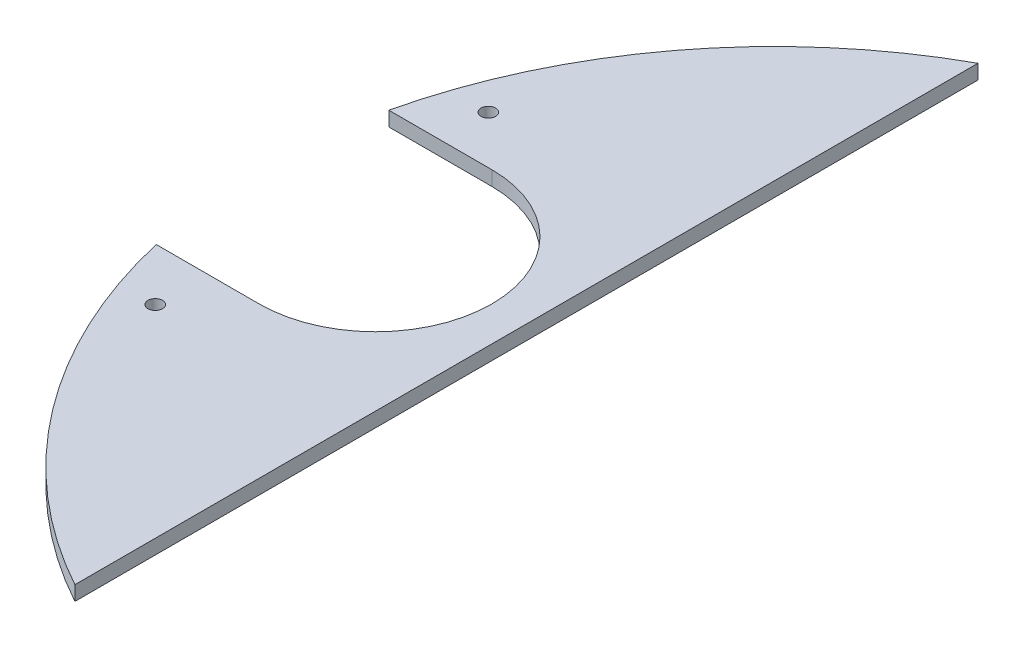
from build123d import *

# Parameters (mm, degrees)
BOSS_EXTRUDE1_DEPTH = 3.175
SKETCH2_R           = 1.5875
SKETCH2_W           = 80.264
SKETCH2_H           = 12.954
CUT_EXTRUDE1_DEPTH  = 223.985606318
SKETCH7_R           = 1.5875
SKETCH7_W           = 46.99
SKETCH7_H           = 138.43
CUT_EXTRUDE4_DEPTH  = 223.985606318
CUT_EXTRUDE5_DEPTH  = 223.985606318
SKETCH9_W           = 300.072277348
SKETCH9_H           = 334.026066528
CUT_EXTRUDE6_DEPTH  = 221.482742149
SKETCH10_R          = 1.5875
CUT_EXTRUDE7_DEPTH  = 214.733203623


with BuildPart() as part:
    # Sketch1 → Boss-Extrude1 (new body)
    with BuildSketch(Plane(origin=(0, 0, 0), x_dir=(1, 0, 0), z_dir=(0, 1, 0))):
        with BuildLine():
            Line((-80, 112.5), (100, 112.5))
            Line((100, 112.5), (100, -112.5))
            Line((100, -112.5), (-80, -112.5))
            ThreePointArc((-80, -112.5), (-192.5, 0), (-80, 112.5))
        make_face()
    extrude(amount=-BOSS_EXTRUDE1_DEPTH)

    # Sketch2 → Cut-Extrude1 (cut, through all)
    with BuildSketch(Plane(origin=(0, 0, 0), x_dir=(1, 0, 0), z_dir=(0, 1, 0))):
        with Locations(Location((36.144045702, -74.2188, 0), (0, 0, 270))):
            Circle(SKETCH2_R)
        with Locations(Location((36.144045702, -67.8688, 0), (0, 0, 270))):
            Circle(SKETCH2_R)
        with Locations(Location((36.144045702, -61.5188, 0), (0, 0, 270))):
            Circle(SKETCH2_R)
        with Locations(Location((36.144045702, -55.1688, 0), (0, 0, 270))):
            Circle(SKETCH2_R)
        with Locations(Location((36.144045702, -48.8188, 0), (0, 0, 270))):
            Circle(SKETCH2_R)
        with Locations(Location((36.144045702, -42.4688, 0), (0, 0, 270))):
            Circle(SKETCH2_R)
        with Locations(Location((36.144045702, -36.1188, 0), (0, 0, 270))):
            Circle(SKETCH2_R)
        with Locations(Location((67.894045702, -74.2188, 0), (0, 0, 270))):
            Circle(SKETCH2_R)
        with Locations(Location((67.894045702, -67.8688, 0), (0, 0, 270))):
            Circle(SKETCH2_R)
        with Locations(Location((67.894045702, -61.5188, 0), (0, 0, 270))):
            Circle(SKETCH2_R)
        with Locations(Location((67.894045702, -55.1688, 0), (0, 0, 270))):
            Circle(SKETCH2_R)
        with Locations(Location((67.894045702, -48.8188, 0), (0, 0, 270))):
            Circle(SKETCH2_R)
        with Locations(Location((67.894045702, -42.4688, 0), (0, 0, 270))):
            Circle(SKETCH2_R)
        with Locations(Location((67.894045702, -36.1188, 0), (0, 0, 270))):
            Circle(SKETCH2_R)
        with Locations(Location((36.144045702, 74.2188, 0), (0, 0, 270))):
            Circle(SKETCH2_R)
        with Locations(Location((36.144045702, 67.8688, 0), (0, 0, 270))):
            Circle(SKETCH2_R)
        with Locations(Location((36.144045702, 61.5188, 0), (0, 0, 270))):
            Circle(SKETCH2_R)
        with Locations(Location((36.144045702, 55.1688, 0), (0, 0, 270))):
            Circle(SKETCH2_R)
        with Locations(Location((36.144045702, 48.8188, 0), (0, 0, 270))):
            Circle(SKETCH2_R)
        with Locations(Location((36.144045702, 42.4688, 0), (0, 0, 270))):
            Circle(SKETCH2_R)
        with Locations(Location((36.144045702, 36.1188, 0), (0, 0, 270))):
            Circle(SKETCH2_R)
        with Locations(Location((67.894045702, 74.2188, 0), (0, 0, 270))):
            Circle(SKETCH2_R)
        with Locations(Location((67.894045702, 67.8688, 0), (0, 0, 270))):
            Circle(SKETCH2_R)
        with Locations(Location((67.894045702, 61.5188, 0), (0, 0, 270))):
            Circle(SKETCH2_R)
        with Locations(Location((67.894045702, 55.1688, 0), (0, 0, 270))):
            Circle(SKETCH2_R)
        with Locations(Location((67.894045702, 48.8188, 0), (0, 0, 270))):
            Circle(SKETCH2_R)
        with Locations(Location((67.894045702, 42.4688, 0), (0, 0, 270))):
            Circle(SKETCH2_R)
        with Locations(Location((67.894045702, 36.1188, 0), (0, 0, 270))):
            Circle(SKETCH2_R)
        with Locations((52.019045702, -96.4438)):
            Rectangle(SKETCH2_W, SKETCH2_H)
        with Locations((52.019045702, 96.4438)):
            Rectangle(SKETCH2_W, SKETCH2_H)
    extrude(amount=-CUT_EXTRUDE1_DEPTH, mode=Mode.SUBTRACT)

    # Sketch7 → Cut-Extrude4 (cut, through all)
    with BuildSketch(Plane(origin=(0, 0, 0), x_dir=(1, 0, 0), z_dir=(0, 1, 0))):
        with Locations(Location((-50.166143469, 0, 0), (0, 0, 270))):
            Circle(SKETCH7_R)
        with Locations(Location((25.582761582, 0, 0), (0, 0, 270))):
            Circle(SKETCH7_R)
        with Locations(Location((87.462148806, 0, 0), (0, 0, 270))):
            Circle(SKETCH7_R)
        with Locations((-13.971143469, 0)):
            Rectangle(SKETCH7_W, SKETCH7_H)
    extrude(amount=-CUT_EXTRUDE4_DEPTH, mode=Mode.SUBTRACT)

    # Sketch8 → Cut-Extrude5 (cut, through all)
    with BuildSketch(Plane(origin=(0, 0, 0), x_dir=(1, 0, 0), z_dir=(0, 1, 0))):
        with BuildLine():
            Line((-167.0966, 25.4), (-229.776686608, 25.4))
            Line((-229.776686608, 25.4), (-229.776686608, -25.4))
            Line((-229.776686608, -25.4), (-167.0966, -25.4))
            ThreePointArc((-167.0966, -25.4), (-141.6966, 0), (-167.0966, 25.4))
        make_face()
    extrude(amount=-CUT_EXTRUDE5_DEPTH, mode=Mode.SUBTRACT)

    # Sketch9 → Cut-Extrude6 (cut, through all)
    with BuildSketch(Plane(origin=(0, 0, 0), x_dir=(1, 0, 0), z_dir=(0, 1, 0))):
        with Locations((15.89966987, 0.169857655)):
            Rectangle(SKETCH9_W, SKETCH9_H)
    extrude(amount=-CUT_EXTRUDE6_DEPTH, mode=Mode.SUBTRACT)

    # Sketch10 → Cut-Extrude7 (cut, through all)
    with BuildSketch(Plane(origin=(0, 0, 0), x_dir=(1, 0, 0), z_dir=(0, 1, 0))):
        with Locations(Location((-178.345859252, -36.864745569, 0), (0, 0, 270))):
            Circle(SKETCH10_R)
        with Locations(Location((-178.345859252, 35.885864147, 0), (0, 0, 270))):
            Circle(SKETCH10_R)
    extrude(amount=-CUT_EXTRUDE7_DEPTH, mode=Mode.SUBTRACT)


solid = part.part
